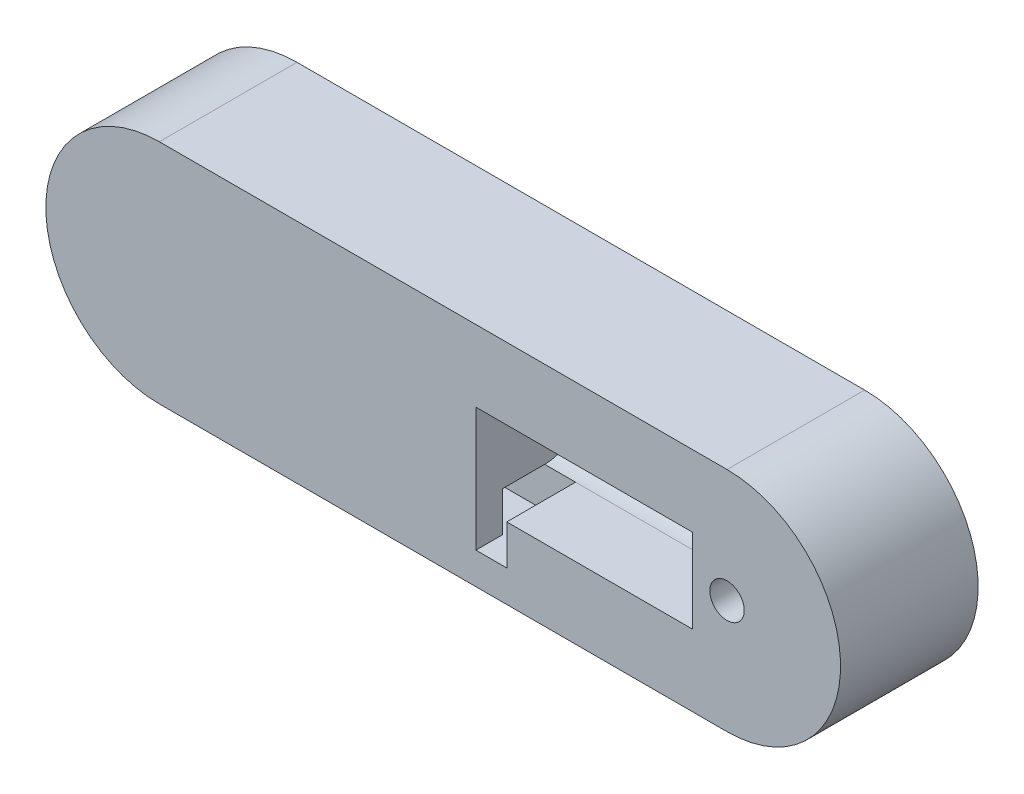
from build123d import *

# Parameters (mm, degrees)
CROQUIS1_R              = 5
SALIENTE_EXTRUIR1_DEPTH = 40
CORTAR_EXTRUIR2_DEPTH   = 10
CORTAR_EXTRUIR4_DEPTH   = 20
CROQUIS6_R              = 12.2
CORTAR_EXTRUIR6_DEPTH   = 63
CROQUIS7_W              = 24.4
CROQUIS7_H              = 24.4
CORTAR_EXTRUIR9_DEPTH   = 30
CROQUIS8_W              = 12.2
CROQUIS8_H              = 11.6
CORTAR_EXTRUIR10_DEPTH  = 85
CORTAR_EXTRUIR11_REACH  = 165.418
CROQUIS9_W              = 11.6
CROQUIS9_H              = 11.6
CHAFL_N1_SIZE           = 10


with BuildPart() as part:
    # Croquis1 → Saliente-Extruir1 (new body)
    with BuildSketch(Plane.XY):
        with BuildLine():
            Line((121.972889038, 33), (-43.027110962, 33))
            ThreePointArc((-43.027110962, 33), (-76.027110962, 0), (-43.027110962, -33))
            Line((-43.027110962, -33), (121.972889038, -33))
            ThreePointArc((121.972889038, -33), (154.972889038, 0), (121.972889038, 33))
        make_face()
        with Locations((121.972889038, 0)):
            Circle(CROQUIS1_R, mode=Mode.SUBTRACT)
    extrude(amount=SALIENTE_EXTRUIR1_DEPTH)

    # Croquis1<4> → Cortar-Extruir2 (cut)
    with BuildSketch(Plane.XY):
        with BuildLine():
            Line((-41.509889959, -1.303088803), (-41.509889959, 1.303088803))
            ThreePointArc((-41.509889959, 1.303088803), (-45.027110962, 0), (-41.509889959, -1.303088803))
        make_face()
    extrude(amount=CORTAR_EXTRUIR2_DEPTH, mode=Mode.SUBTRACT)

    # Croquis5 → Cortar-Extruir4 (cut)
    with BuildSketch(Plane.XY.offset(40)):
        Polygon((111.972889038, -12.2), (111.972889038, 12.2), (48.972889038, 12.2), (48.972889038, -23.8), (57.948493167, -23.8), (57.948493167, -12.2), align=None)
    extrude(amount=-CORTAR_EXTRUIR4_DEPTH, mode=Mode.SUBTRACT)

    # Croquis6 → Cortar-Extruir6 (cut)
    with BuildSketch(Plane(origin=(48.972889038, 0, 0), x_dir=(0, 0, -1), z_dir=(1, 0, 0))):
        with Locations((-20, 0)):
            Circle(CROQUIS6_R)
        with BuildLine():
            ThreePointArc((-20, -12.2), (-32.2, 0), (-20, 12.2))
            Line((-20, 12.2), (-40, 12.2))
            Line((-40, 12.2), (-40, -12.2))
            Line((-40, -12.2), (-20, -12.2))
        make_face()
    extrude(amount=CORTAR_EXTRUIR6_DEPTH, mode=Mode.SUBTRACT)

    # Croquis7 → Cortar-Extruir9 (cut)
    with BuildSketch(Plane.ZY.offset(-111.972889038)):
        with Locations((20, 0)):
            Rectangle(CROQUIS7_W, CROQUIS7_H)
    extrude(amount=-CORTAR_EXTRUIR9_DEPTH, mode=Mode.SUBTRACT)

    # Croquis8 → Cortar-Extruir10 (cut)
    with BuildSketch(Plane(origin=(48.972889038, 0, 0), x_dir=(0, 0, -1), z_dir=(1, 0, 0))):
        with Locations((-26.1, -18)):
            Rectangle(CROQUIS8_W, CROQUIS8_H)
    extrude(amount=-CORTAR_EXTRUIR10_DEPTH, mode=Mode.SUBTRACT)

    # Croquis9 → Cortar-Extruir11 (cut, up to next)
    with BuildSketch(Plane(origin=(0, 0, 0), x_dir=(-1, 0, 0), z_dir=(0, 0, -1)), mode=Mode.PRIVATE) as cortar_extruir11_sk1:
        with Locations((30.227110962, -18)):
            Rectangle(CROQUIS9_W, CROQUIS9_H)
    cortar_extruir11_tool1 = extrude(cortar_extruir11_sk1.sketch, amount=-CORTAR_EXTRUIR11_REACH, mode=Mode.PRIVATE) & part.part
    add(cortar_extruir11_tool1.solids().sort_by_distance((-30.227111, -18, 0))[0], mode=Mode.SUBTRACT)

    # Chaflán1
    chafl_n1_edges = [part.edges().sort_by_distance(p)[0] for p in [
        (-36.027110962, -18, 0),
    ]]
    chamfer(chafl_n1_edges, length=CHAFL_N1_SIZE)


solid = part.part
